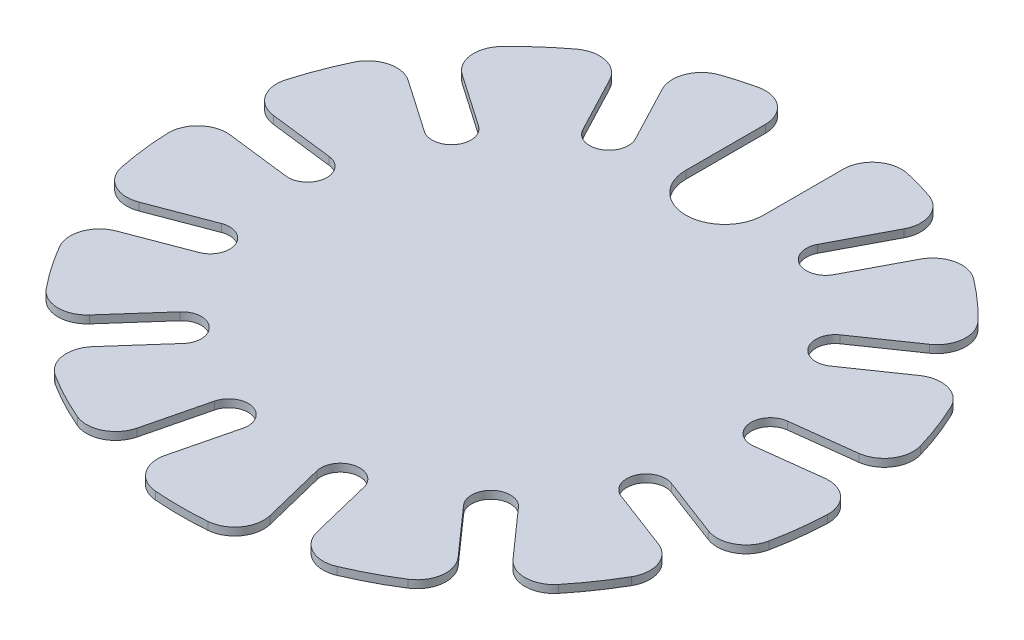
from build123d import *

# Parameters (mm, degrees)
BOSS_EXTRUDE1_DEPTH     = 0.1
CUT_EXTRUDE1_DEPTH      = 13.021231218
CUT_EXTRUDE1_DEPTH_BACK = 13.021231218
FILLET1_R               = 0.75


with BuildPart() as part:
    # Sketch1 → Boss-Extrude1 (new, symmetric)
    with BuildSketch(Plane(origin=(0, 0, 0), x_dir=(1, 0, 0), z_dir=(0, 1, 0))):
        with BuildLine():
            Line((-0.5, 6), (-0.5, 8.485281374))
            ThreePointArc((-0.5, 8.485281374), (-2.034183146, 8.253005448), (-3.500578863, 7.745705108))
            Line((-3.500578863, 7.745705108), (-2.345611019, 5.54509774))
            ThreePointArc((-2.345611019, 5.54509774), (-2.555977446, 4.870008141), (-3.231067045, 5.080374568))
            Line((-3.231067045, 5.080374568), (-4.386034889, 7.280981936))
            ThreePointArc((-4.386034889, 7.280981936), (-5.636542595, 6.362341359), (-6.699217295, 5.231681148))
            Line((-6.699217295, 5.231681148), (-4.653870822, 3.819880413))
            ThreePointArc((-4.653870822, 3.819880413), (-4.526411262, 3.124356107), (-5.221935569, 2.996896547))
            Line((-5.221935569, 2.996896547), (-7.267282042, 4.408697282))
            ThreePointArc((-7.267282042, 4.408697282), (-7.947638063, 3.01414154), (-8.363145779, 1.519142085))
            Line((-8.363145779, 1.519142085), (-5.895984904, 1.219574519))
            ThreePointArc((-5.895984904, 1.219574519), (-5.459898808, 0.662951741), (-6.016521585, 0.226865644))
            Line((-6.016521585, 0.226865644), (-8.48368246, 0.526433211))
            ThreePointArc((-8.48368246, 0.526433211), (-8.43802543, -1.024561782), (-8.111178352, -2.541414122))
            Line((-8.111178352, -2.541414122), (-5.7873999, -1.660121201))
            ThreePointArc((-5.7873999, -1.660121201), (-5.142589335, -1.950326879), (-5.432795013, -2.595137444))
            Line((-5.432795013, -2.595137444), (-7.756573465, -3.476430365))
            ThreePointArc((-7.756573465, -3.476430365), (-6.99536286, -4.828550347), (-6.001037715, -6.019762981))
            Line((-6.001037715, -6.019762981), (-4.352991324, -4.15950316))
            ThreePointArc((-4.352991324, -4.15950316), (-3.64717462, -4.116809115), (-3.604480575, -4.822625818))
            Line((-3.604480575, -4.822625818), (-5.252526967, -6.682885639))
            ThreePointArc((-5.252526967, -6.682885639), (-3.950146962, -7.526376218), (-2.516131657, -8.119056687))
            Line((-2.516131657, -8.119056687), (-1.921364894, -5.705993072))
            ThreePointArc((-1.921364894, -5.705993072), (-1.316236154, -5.340179996), (-0.950423077, -5.945308737))
            Line((-0.950423077, -5.945308737), (-1.54518984, -8.358372351))
            ThreePointArc((-1.54518984, -8.358372351), (0, -8.5), (1.54518984, -8.358372351))
            Line((1.54518984, -8.358372351), (0.950423077, -5.945308737))
            ThreePointArc((0.950423077, -5.945308737), (1.316236154, -5.340179996), (1.921364894, -5.705993072))
            Line((1.921364894, -5.705993072), (2.516131657, -8.119056687))
            ThreePointArc((2.516131657, -8.119056687), (3.950146962, -7.526376218), (5.252526967, -6.682885639))
            Line((5.252526967, -6.682885639), (3.604480575, -4.822625818))
            ThreePointArc((3.604480575, -4.822625818), (3.64717462, -4.116809115), (4.352991324, -4.15950316))
            Line((4.352991324, -4.15950316), (6.001037715, -6.019762981))
            ThreePointArc((6.001037715, -6.019762981), (6.99536286, -4.828550347), (7.756573465, -3.476430365))
            Line((7.756573465, -3.476430365), (5.432795013, -2.595137444))
            ThreePointArc((5.432795013, -2.595137444), (5.142589335, -1.950326879), (5.7873999, -1.660121201))
            Line((5.7873999, -1.660121201), (8.111178352, -2.541414122))
            ThreePointArc((8.111178352, -2.541414122), (8.43802543, -1.024561782), (8.48368246, 0.526433211))
            Line((8.48368246, 0.526433211), (6.016521585, 0.226865644))
            ThreePointArc((6.016521585, 0.226865644), (5.459898808, 0.662951741), (5.895984904, 1.219574519))
            Line((5.895984904, 1.219574519), (8.363145779, 1.519142085))
            ThreePointArc((8.363145779, 1.519142085), (7.947638063, 3.01414154), (7.267282042, 4.408697282))
            Line((7.267282042, 4.408697282), (5.221935569, 2.996896547))
            ThreePointArc((5.221935569, 2.996896547), (4.526411262, 3.124356107), (4.653870822, 3.819880413))
            Line((4.653870822, 3.819880413), (6.699217295, 5.231681148))
            ThreePointArc((6.699217295, 5.231681148), (5.636542595, 6.362341359), (4.386034889, 7.280981936))
            Line((4.386034889, 7.280981936), (3.231067045, 5.080374568))
            ThreePointArc((3.231067045, 5.080374568), (2.555977446, 4.870008141), (2.345611019, 5.54509774))
            Line((2.345611019, 5.54509774), (3.500578863, 7.745705108))
            ThreePointArc((3.500578863, 7.745705108), (2.034183146, 8.253005448), (0.5, 8.485281374))
            Line((0.5, 8.485281374), (0.5, 6))
            ThreePointArc((0.5, 6), (0, 5.5), (-0.5, 6))
        make_face()
    extrude(amount=BOSS_EXTRUDE1_DEPTH, both=True)

    # Sketch2 → Cut-Extrude1 (cut, two sides: drawn at the far end of the back side and taken through both)
    with BuildSketch(Plane(origin=(0, 0, 0), x_dir=(1, 0, 0), z_dir=(0, 1, 0)).offset(-CUT_EXTRUDE1_DEPTH_BACK)):
        with BuildLine():
            Line((-1, 5.5), (-1, 8.485281374))
            Line((-1, 8.485281374), (1, 8.485281374))
            Line((1, 8.485281374), (1, 5.5))
            ThreePointArc((1, 5.5), (0, 4.5), (-1, 5.5))
        make_face()
    extrude(amount=CUT_EXTRUDE1_DEPTH + CUT_EXTRUDE1_DEPTH_BACK, mode=Mode.SUBTRACT)

    # Fillet1
    fillet1_edges = [part.edges().sort_by_distance(p)[0] for p in [
        (-1, 0, -8.440971508),
        (1, 0, -8.440971508),
        (3.500578863, 0, -7.745705108),
        (4.386034889, 0, -7.280981936),
        (6.699217295, 0, -5.231681148),
        (7.267282042, 0, -4.408697282),
        (8.363145779, 0, -1.519142085),
        (8.48368246, 0, -0.526433211),
        (8.111178352, 0, 2.541414122),
        (7.756573465, 0, 3.476430365),
        (6.001037715, 0, 6.019762981),
        (5.252526967, 0, 6.682885639),
        (2.516131657, 0, 8.119056687),
        (1.54518984, 0, 8.358372351),
        (-1.54518984, 0, 8.358372351),
        (-2.516131657, 0, 8.119056687),
        (-5.252526967, 0, 6.682885639),
        (-6.001037715, 0, 6.019762981),
        (-7.756573465, 0, 3.476430365),
        (-8.111178352, 0, 2.541414122),
        (-8.48368246, 0, -0.526433211),
        (-8.363145779, 0, -1.519142085),
        (-7.267282042, 0, -4.408697282),
        (-6.699217295, 0, -5.231681148),
        (-4.386034889, 0, -7.280981936),
        (-3.500578863, 0, -7.745705108),
    ]]
    fillet(fillet1_edges, radius=FILLET1_R)


solid = part.part
